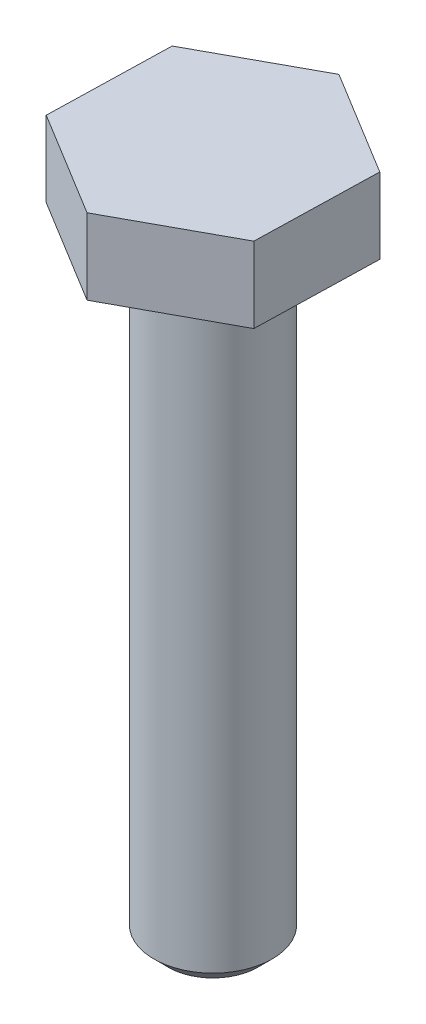
from build123d import *

# Parameters (mm, degrees)
BOSS_EXTRUDE1_DEPTH = 4.064
SKETCH2_R           = 3.175
BOSS_EXTRUDE2_DEPTH = 33.02
CHAMFER1_SIZE       = 0.762


with BuildPart() as part:
    # Sketch1 → Boss-Extrude1 (new body)
    with BuildSketch(Plane(origin=(0, 0, 0), x_dir=(1, 0, 0), z_dir=(0, 1, 0))):
        Polygon((5.631533532, -3.440077045), (5.794960878, 3.157012579), (0.163427345, 6.597089624), (-5.631533532, 3.440077045), (-5.794960878, -3.157012579), (-0.163427345, -6.597089624), align=None)
    extrude(amount=BOSS_EXTRUDE1_DEPTH)

    # Sketch2 → Boss-Extrude2 (add)
    with BuildSketch(Plane(origin=(0, 0, 0), x_dir=(-1, 0, 0), z_dir=(0, -1, 0))):
        with Locations(Location((0, 0, 0), (0, 0, 90))):
            Circle(SKETCH2_R)
    extrude(amount=BOSS_EXTRUDE2_DEPTH)

    # Chamfer1
    chamfer1_edges = [part.edges().sort_by_distance(p)[0] for p in [
        (0, -33.02, 3.175),
    ]]
    chamfer(chamfer1_edges, length=CHAMFER1_SIZE)


solid = part.part
